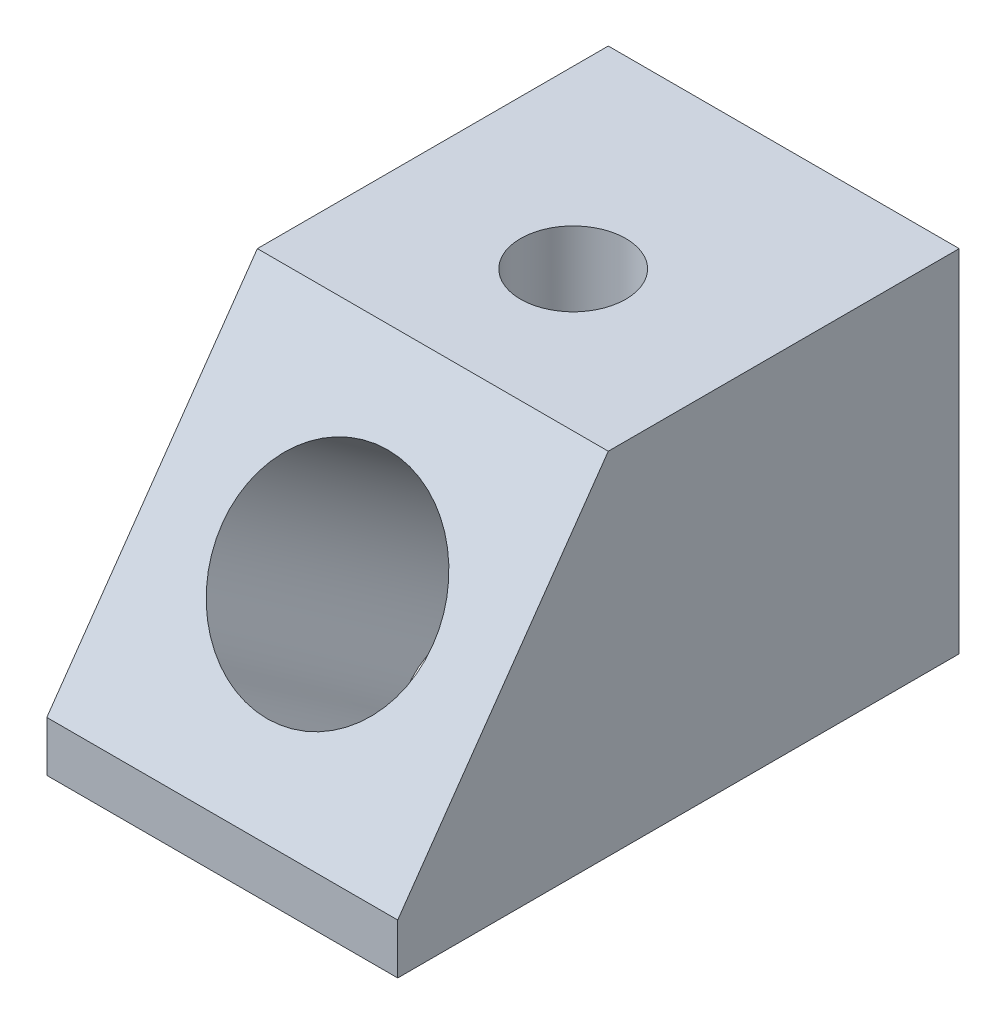
from build123d import *

# Parameters (mm, degrees)
SKETCH_1_W          = 10
SKETCH_1_H          = 16
SKETCH_1_R          = 1.5
EXTRUDE_1_DEPTH     = 10
CUT_EXTRUDE_1_DEPTH = 10
SKETCH_3_R          = 3
CUT_EXTRUDE_2_DEPTH = 22.65119524


with BuildPart() as part:
    # 草图1 → 凸台-拉伸1 (new body)
    with BuildSketch(Plane(origin=(0, 0, 0), x_dir=(1, 0, 0), z_dir=(0, 1, 0))):
        with Locations((5, 8)):
            Rectangle(SKETCH_1_W, SKETCH_1_H)
        with Locations(Location((5, 10, 0), (0, 0, 270))):
            Circle(SKETCH_1_R, mode=Mode.SUBTRACT)
    extrude(amount=EXTRUDE_1_DEPTH)

    # 草图2 → 切除-拉伸1 (cut)
    with BuildSketch(Plane(origin=(10, 0, 0), x_dir=(0, 0, -1), z_dir=(1, 0, 0))):
        Polygon((0, 1.43111196), (6, 10), (0, 10), align=None)
    extrude(amount=-CUT_EXTRUDE_1_DEPTH, mode=Mode.SUBTRACT)

    # 草图3 → 切除-拉伸2 (cut, through all)
    with BuildSketch(Plane(origin=(0, 0.470821421, 0.672402674), x_dir=(1, 0, 0), z_dir=(0, 0.5735764363510438, 0.8191520442889935))):
        with Locations(Location((5, 6.402638674, 0), (0, 0, 270))):
            Circle(SKETCH_3_R)
    extrude(amount=-CUT_EXTRUDE_2_DEPTH, mode=Mode.SUBTRACT)


solid = part.part
